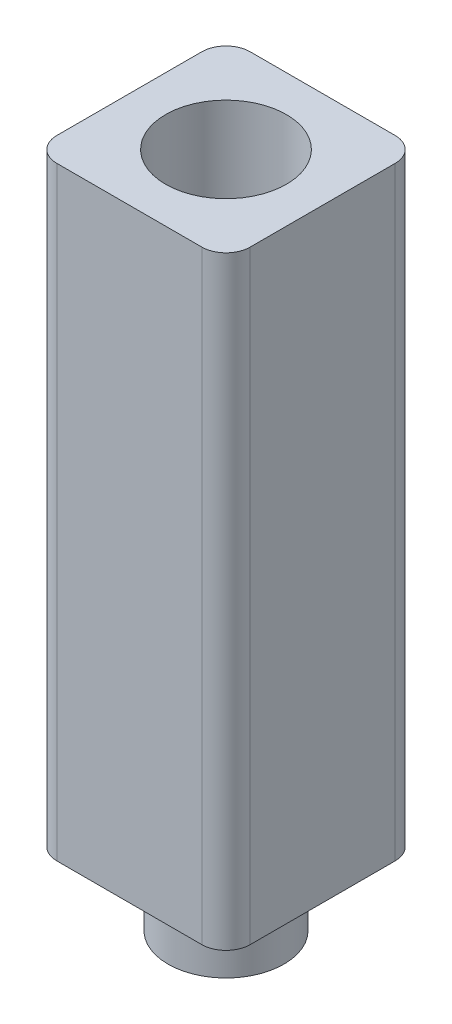
from build123d import *

# Parameters (mm, degrees)
SKETCH1_R           = 2.4
BOSS_EXTRUDE1_DEPTH = 3
SKETCH2_W           = 8
SKETCH2_H           = 8
BOSS_EXTRUDE2_DEPTH = 25
SKETCH3_R           = 2.5
CUT_EXTRUDE1_DEPTH  = 4
FILLET1_R           = 1


with BuildPart() as part:
    # Sketch1 → Boss-Extrude1 (new body)
    with BuildSketch(Plane(origin=(0, 0, 0), x_dir=(1, 0, 0), z_dir=(0, 1, 0))):
        with Locations(Location((0, 0, 0), (0, 0, 270))):
            Circle(SKETCH1_R)
    extrude(amount=BOSS_EXTRUDE1_DEPTH)

    # Sketch2 → Boss-Extrude2 (add)
    with BuildSketch(Plane(origin=(0, 3, 0), x_dir=(1, 0, 0), z_dir=(0, 1, 0))):
        Rectangle(SKETCH2_W, SKETCH2_H)
    extrude(amount=BOSS_EXTRUDE2_DEPTH)

    # Sketch3 → Cut-Extrude1 (cut)
    with BuildSketch(Plane(origin=(0, 28, 0), x_dir=(1, 0, 0), z_dir=(0, 1, 0))):
        with Locations(Location((0, 0, 0), (0, 0, 270))):
            Circle(SKETCH3_R)
    extrude(amount=-CUT_EXTRUDE1_DEPTH, mode=Mode.SUBTRACT)

    # Fillet1
    fillet1_edges = [part.edges().sort_by_distance(p)[0] for p in [
        (4, 15.5, 4),
        (4, 15.5, -4),
        (-4, 15.5, -4),
        (-4, 15.5, 4),
    ]]
    fillet(fillet1_edges, radius=FILLET1_R)


solid = part.part
